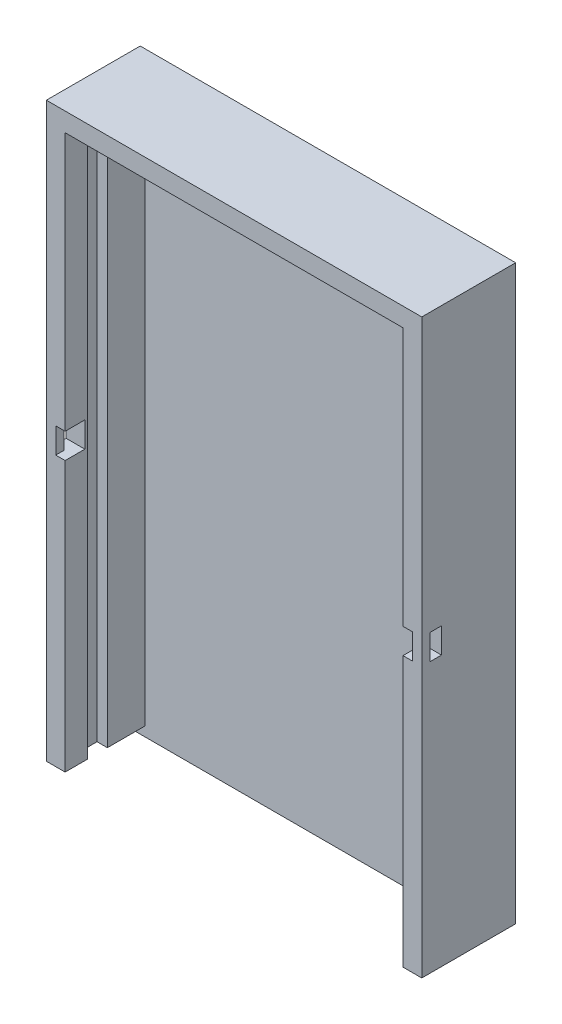
from build123d import *

# Parameters (mm, degrees)
SKETCH_1_W          = 40
SKETCH_1_H          = 62
EXTRUDE_1_DEPTH     = 10
SKETCH_2_W          = 36
SKETCH_2_H          = 58
CUT_EXTRUDE_1_DEPTH = 8.5
SKETCH_4_W          = 36
SKETCH_4_H          = 8.5
CUT_EXTRUDE_2_DEPTH = 2
SKETCH_5_W          = 38.2
SKETCH_5_H          = 2.1
CUT_EXTRUDE_3_DEPTH = 60
SKETCH_6_W          = 40
SKETCH_6_H          = 10
CUT_EXTRUDE_4_DEPTH = 1
SKETCH_7_W          = 38.4
SKETCH_7_H          = 1.5
EXTRUDE_2_DEPTH     = 1
SKETCH_8_W          = 1.2
SKETCH_8_H          = 2.7
CUT_EXTRUDE_5_DEPTH = 52.584881506
SKETCH_10_W         = 0.9
SKETCH_10_H         = 2.7
CUT_EXTRUDE_6_DEPTH = 1


with BuildPart() as part:
    # 草图1 → 凸台-拉伸1 (new body)
    with BuildSketch(Plane.XY):
        Rectangle(SKETCH_1_W, SKETCH_1_H)
    extrude(amount=EXTRUDE_1_DEPTH)

    # 草图2 → 切除-拉伸1 (cut)
    with BuildSketch(Plane.XY.offset(10)):
        Rectangle(SKETCH_2_W, SKETCH_2_H)
    extrude(amount=-CUT_EXTRUDE_1_DEPTH, mode=Mode.SUBTRACT)

    # 草图4 → 切除-拉伸2 (cut)
    with BuildSketch(Plane.XZ.offset(31)):
        with Locations((0, 5.75)):
            Rectangle(SKETCH_4_W, SKETCH_4_H)
    extrude(amount=-CUT_EXTRUDE_2_DEPTH, mode=Mode.SUBTRACT)

    # 草图5 → 切除-拉伸3 (cut)
    with BuildSketch(Plane.XZ.offset(31)):
        with Locations((0, 6.55)):
            Rectangle(SKETCH_5_W, SKETCH_5_H)
    extrude(amount=-CUT_EXTRUDE_3_DEPTH, mode=Mode.SUBTRACT)

    # 草图6 → 切除-拉伸4 (cut)
    with BuildSketch(Plane.XZ.offset(31)):
        with Locations((0, 5)):
            Rectangle(SKETCH_6_W, SKETCH_6_H)
    extrude(amount=-CUT_EXTRUDE_4_DEPTH, mode=Mode.SUBTRACT)

    # 草图7 → 凸台-拉伸2 (add)
    with BuildSketch(Plane.XZ.offset(30)):
        with Locations((-0.2, 0.75)):
            Rectangle(SKETCH_7_W, SKETCH_7_H)
    extrude(amount=EXTRUDE_2_DEPTH)

    # 草图8 → 切除-拉伸5 (cut, through all)
    with BuildSketch(Plane.ZY.offset(20)):
        with Locations((8.5, 0.1)):
            Rectangle(SKETCH_8_W, SKETCH_8_H)
    extrude(amount=-CUT_EXTRUDE_5_DEPTH, mode=Mode.SUBTRACT)

    # 草图10 → 切除-拉伸6 (cut)
    with BuildSketch(Plane(origin=(-18, 0, 0), x_dir=(0, 0, -1), z_dir=(1, 0, 0))):
        with Locations((-9.55, 0.1)):
            Rectangle(SKETCH_10_W, SKETCH_10_H)
    cut_extrude_6 = extrude(amount=-CUT_EXTRUDE_6_DEPTH, mode=Mode.SUBTRACT)

    # 镜向1: 切除-拉伸6 across plane
    add(cut_extrude_6.mirror(Plane(origin=(0, 0, 0), x_dir=(0, 0, 1), z_dir=(1, 0, 0))), mode=Mode.SUBTRACT)


solid = part.part
